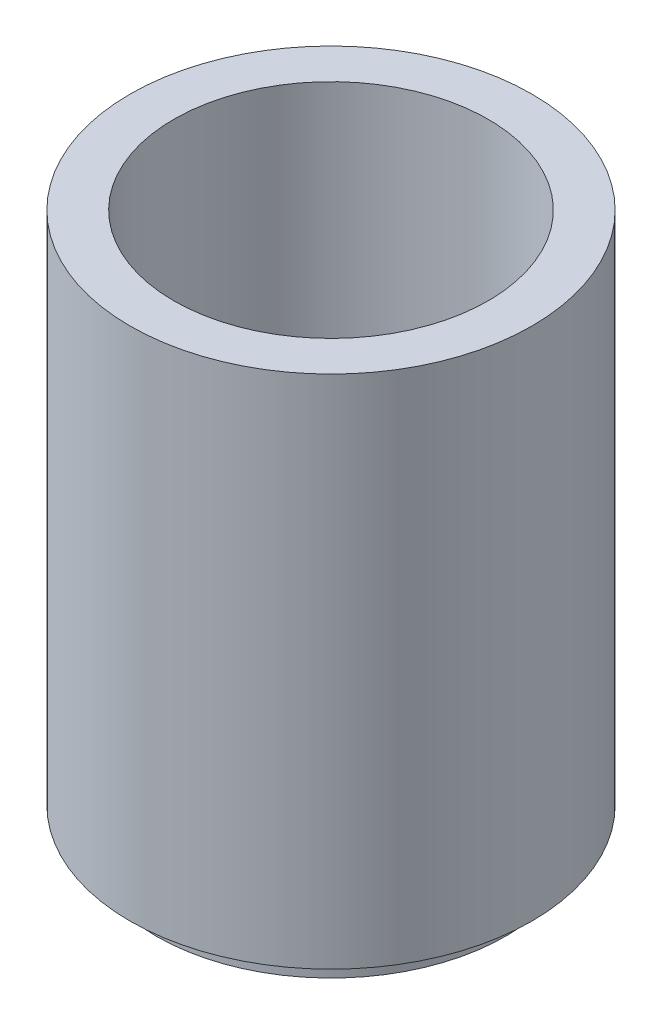
from build123d import *


with BuildPart() as part:
    # Sketch2 → Revolve1 (revolve)
    with BuildSketch(Plane.XY, mode=Mode.PRIVATE) as revolve1_sk:
        Polygon((9, -23), (9, 0), (11.5, 0), (11.5, -29.5), (10, -29.5), (10, -31), (8, -31), (8, -23), align=None)
    revolve(revolve1_sk.sketch.rotate(Axis((0, 34, 0), (0, -1, 0)), 90), axis=Axis((0, 34, 0), (0, -1, 0)))


solid = part.part
